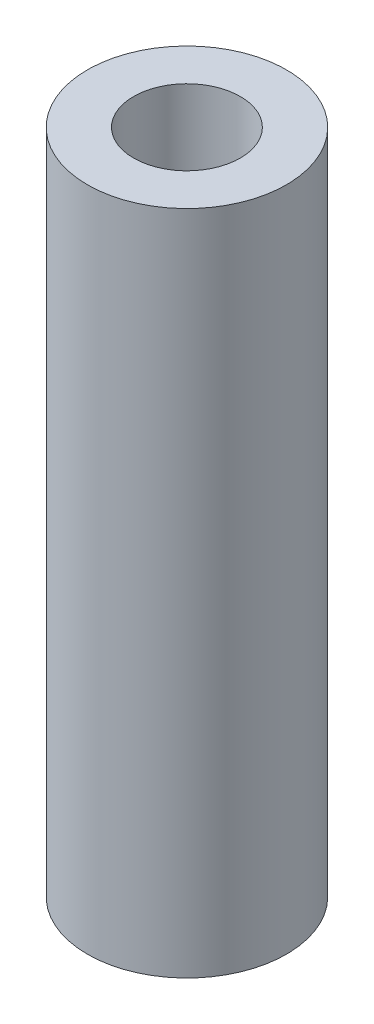
from build123d import *

# Parameters (mm, degrees)
SKETCH1_R           = 4.7625
SKETCH1_R_2         = 2.5527
BOSS_EXTRUDE1_DEPTH = 31.877


with BuildPart() as part:
    # Sketch1 → Boss-Extrude1 (new body)
    with BuildSketch(Plane(origin=(0, 0, 0), x_dir=(1, 0, 0), z_dir=(0, 1, 0))):
        with Locations(Location((0, 0, 0), (0, 0, 270))):
            Circle(SKETCH1_R)
        with Locations(Location((0, 0, 0), (0, 0, 270))):
            Circle(SKETCH1_R_2, mode=Mode.SUBTRACT)
    extrude(amount=BOSS_EXTRUDE1_DEPTH)


solid = part.part
